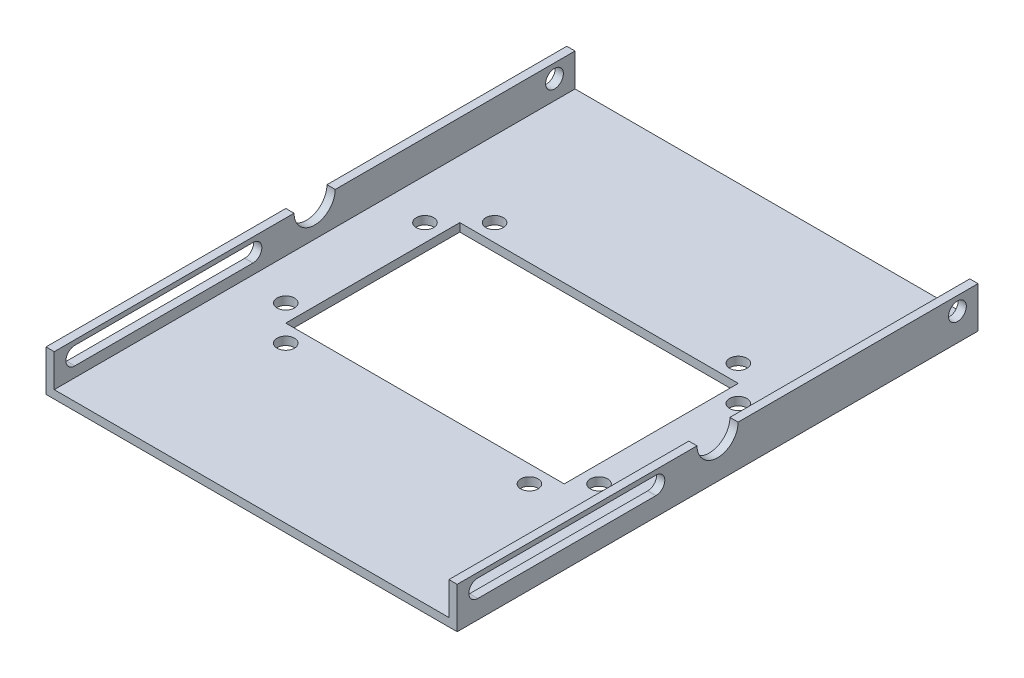
from build123d import *

# Parameters (mm, degrees)
EXTRUDE_THIN1_DEPTH      = 95
EXTRUDE_THIN1_DEPTH_BACK = 95
SKETCH2_R                = 3.2385
CUT_EXTRUDE1_DEPTH       = 179.185296812
CUT_EXTRUDE2_DEPTH       = 179.185296812
CUT_EXTRUDE2_DEPTH_BACK  = 179.185296812
SKETCH3_R                = 7.5
SKETCH4_R                = 3.175
SKETCH4_W                = 101.6
SKETCH4_H                = 63.5
CUT_EXTRUDE3_DEPTH       = 10


with BuildPart() as part:
    # Sketch1 → Extrude-Thin1 (new, two sides: drawn at the far end of the back side and taken through both)
    with BuildSketch(Plane.XY.offset(-EXTRUDE_THIN1_DEPTH_BACK)):
        Polygon((-75, 15), (-75, 0), (75, 0), (75, 15), (72, 15), (72, 3), (-72, 3), (-72, 15), align=None)
    extrude(amount=EXTRUDE_THIN1_DEPTH + EXTRUDE_THIN1_DEPTH_BACK)

    # Sketch2 → Cut-Extrude1 (cut, through all)
    with BuildSketch(Plane.ZY.offset(75)):
        with Locations((-87.5, 10)):
            Circle(SKETCH2_R)
        with BuildLine():
            Line((87.5, 6.7615), (22.5, 6.7615))
            ThreePointArc((22.5, 6.7615), (19.2615, 10), (22.5, 13.2385))
            Line((22.5, 13.2385), (87.5, 13.2385))
            ThreePointArc((87.5, 13.2385), (90.7385, 10), (87.5, 6.7615))
        make_face()
    extrude(amount=-CUT_EXTRUDE1_DEPTH, mode=Mode.SUBTRACT)

    # Sketch3 → Cut-Extrude2 (cut, two sides: drawn at the far end of the back side and taken through both)
    with BuildSketch(Plane(origin=(75, 0, 0), x_dir=(0, 0, -1), z_dir=(1, 0, 0)).offset(-CUT_EXTRUDE2_DEPTH_BACK)):
        with Locations((0, 15)):
            Circle(SKETCH3_R)
    extrude(amount=CUT_EXTRUDE2_DEPTH + CUT_EXTRUDE2_DEPTH_BACK, mode=Mode.SUBTRACT)

    # Sketch4 → Cut-Extrude3 (cut)
    with BuildSketch(Plane(origin=(0, 3, 0), x_dir=(1, 0, 0), z_dir=(0, 1, 0))):
        with Locations(Location((-44.45, 38.1, 0), (0, 0, 270))):
            Circle(SKETCH4_R)
        with Locations(Location((44.45, 38.1, 0), (0, 0, 270))):
            Circle(SKETCH4_R)
        with Locations(Location((-44.45, -38.1, 0), (0, 0, 270))):
            Circle(SKETCH4_R)
        with Locations(Location((44.45, -38.1, 0), (0, 0, 270))):
            Circle(SKETCH4_R)
        with Locations(Location((-57.15, 25.4, 0), (0, 0, 270))):
            Circle(SKETCH4_R)
        with Locations(Location((57.15, 25.4, 0), (0, 0, 270))):
            Circle(SKETCH4_R)
        with Locations(Location((-57.15, -25.4, 0), (0, 0, 270))):
            Circle(SKETCH4_R)
        with Locations(Location((57.15, -25.4, 0), (0, 0, 270))):
            Circle(SKETCH4_R)
        Rectangle(SKETCH4_W, SKETCH4_H)
    extrude(amount=-CUT_EXTRUDE3_DEPTH, mode=Mode.SUBTRACT)


solid = part.part
